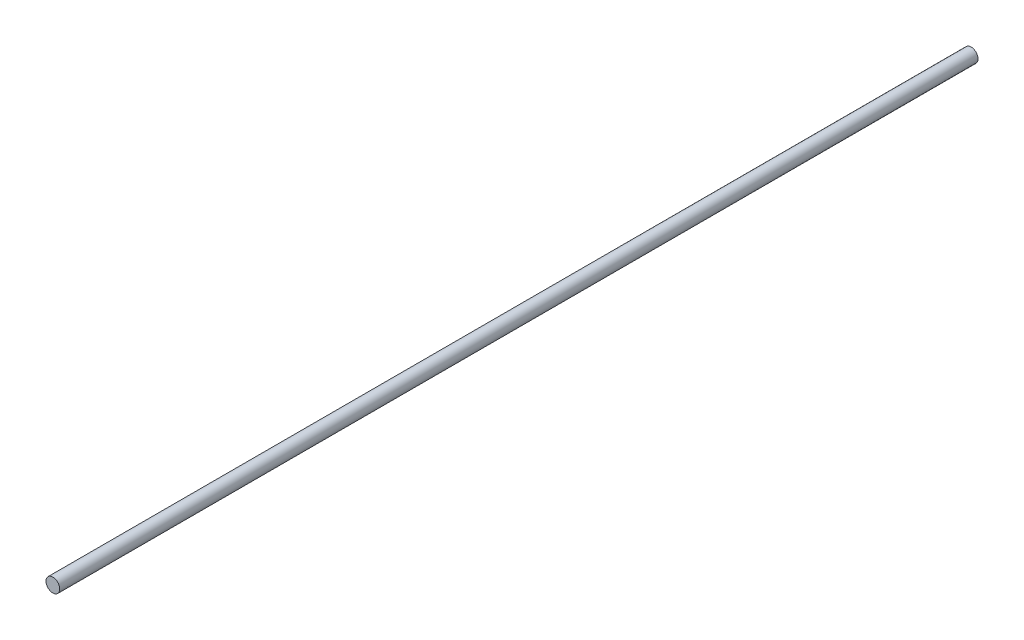
from build123d import *

# Parameters (mm, degrees)
SKETCH1_R           = 3
BOSS_EXTRUDE1_DEPTH = 400


with BuildPart() as part:
    # Sketch1 → Boss-Extrude1 (new body)
    with BuildSketch(Plane.XY):
        Circle(SKETCH1_R)
    extrude(amount=BOSS_EXTRUDE1_DEPTH)


solid = part.part
